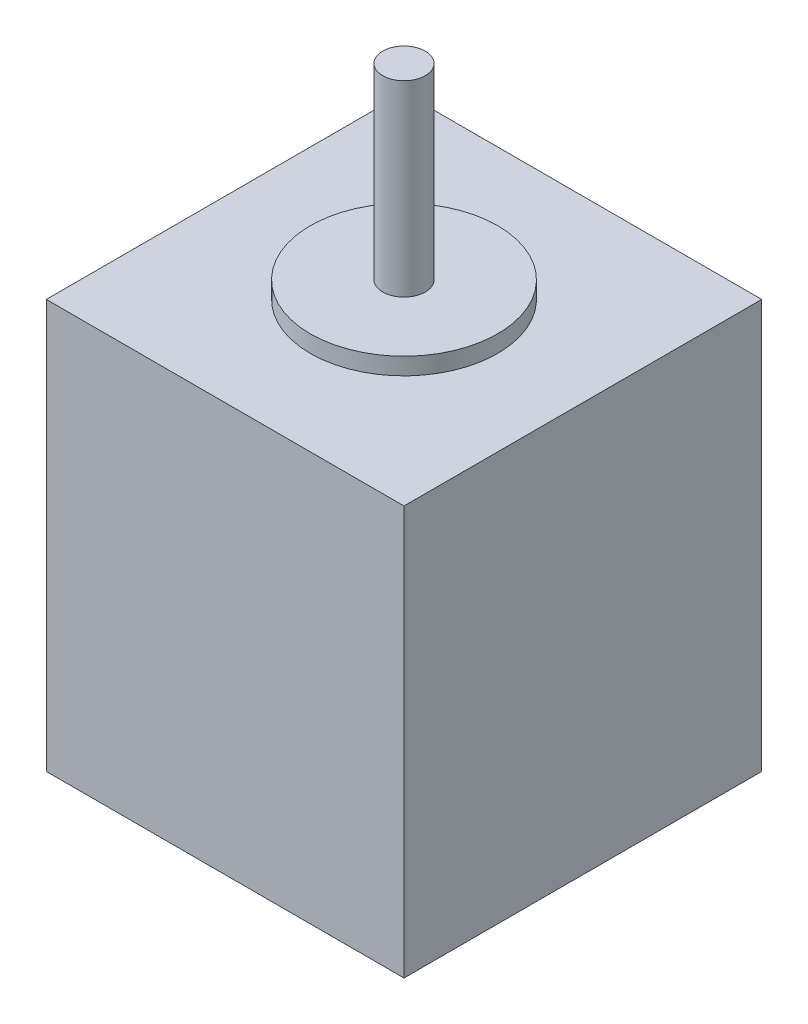
from build123d import *

# Parameters (mm, degrees)
SKETCH1_W           = 42
SKETCH1_H           = 42
BOSS_EXTRUDE2_DEPTH = 48
SKETCH5_R           = 11
BOSS_EXTRUDE3_DEPTH = 2
SKETCH6_R           = 2.5
BOSS_EXTRUDE4_DEPTH = 22


with BuildPart() as part:
    # Sketch1 → Boss-Extrude2 (new body)
    with BuildSketch(Plane(origin=(0, 0, 0), x_dir=(1, 0, 0), z_dir=(0, 1, 0))):
        Rectangle(SKETCH1_W, SKETCH1_H)
    extrude(amount=-BOSS_EXTRUDE2_DEPTH)

    # Sketch5 → Boss-Extrude3 (add)
    with BuildSketch(Plane(origin=(0, 0, 0), x_dir=(1, 0, 0), z_dir=(0, 1, 0))):
        with Locations(Location((0, 0, 0), (0, 0, 270))):
            Circle(SKETCH5_R)
    extrude(amount=BOSS_EXTRUDE3_DEPTH)

    # Sketch6 → Boss-Extrude4 (add)
    with BuildSketch(Plane(origin=(0, 2, 0), x_dir=(1, 0, 0), z_dir=(0, 1, 0))):
        with Locations(Location((0, 0, 0), (0, 0, 270))):
            Circle(SKETCH6_R)
    extrude(amount=BOSS_EXTRUDE4_DEPTH)


solid = part.part
